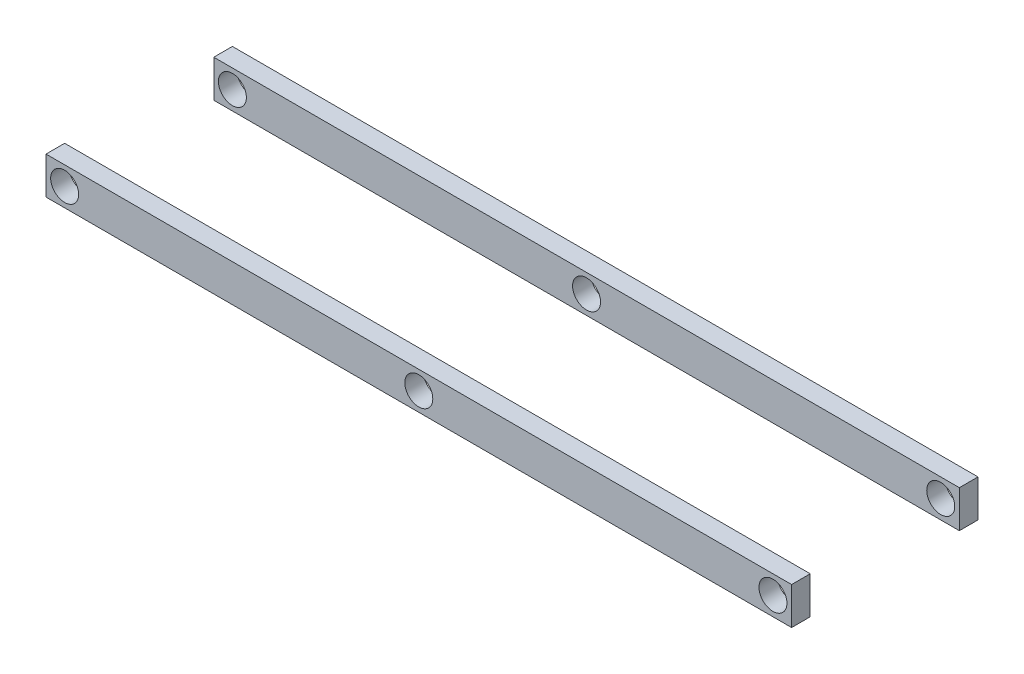
from build123d import *

# Parameters (mm, degrees)
SKETCH1_W           = 40
SKETCH1_H           = 10
BOSS_EXTRUDE1_DEPTH = 2
SKETCH4_W           = 40
SKETCH4_H           = 8
CUT_EXTRUDE2_DEPTH  = 2
SKETCH5_R           = 0.75
CUT_EXTRUDE3_DEPTH  = 42.279534881


with BuildPart() as part:
    # Sketch1 → Boss-Extrude1 (new body)
    with BuildSketch(Plane(origin=(0, 0, 0), x_dir=(1, 0, 0), z_dir=(0, 1, 0))):
        with Locations((20, 5)):
            Rectangle(SKETCH1_W, SKETCH1_H)
    extrude(amount=BOSS_EXTRUDE1_DEPTH)

    # Sketch4 → Cut-Extrude2 (cut)
    with BuildSketch(Plane(origin=(0, 2, 0), x_dir=(1, 0, 0), z_dir=(0, 1, 0))):
        with Locations((20, 5)):
            Rectangle(SKETCH4_W, SKETCH4_H)
    extrude(amount=-CUT_EXTRUDE2_DEPTH, mode=Mode.SUBTRACT)


with BuildPart() as cut_extrude2_piece_1:
    # of the separate pieces the step leaves, piece 1, a body of its own (cut_extrude2_pieces)
    add(part.part.solids().sort_by_distance((0, 0, 0))[0])


with BuildPart() as cut_extrude2_piece_2:
    # of the separate pieces the step leaves, piece 2, a body of its own (cut_extrude2_pieces)
    add(part.part.solids().sort_by_distance((0, 0, -10))[0])


with BuildPart() as cut_extrude3_tool:
    # Sketch5 → Cut-Extrude3 (new, through all)
    with BuildSketch(Plane.XY):
        with Locations((20, 1)):
            Circle(SKETCH5_R)
        with Locations((1, 1)):
            Circle(SKETCH5_R)
        with Locations((39, 1)):
            Circle(SKETCH5_R)
    extrude(amount=-CUT_EXTRUDE3_DEPTH)


with BuildPart() as cut_extrude2_piece_1_1:
    add(cut_extrude2_piece_1.part)

    # Cut-Extrude3: cut by cut_extrude3_tool
    add(cut_extrude3_tool.part, mode=Mode.SUBTRACT)


with BuildPart() as cut_extrude2_piece_2_1:
    add(cut_extrude2_piece_2.part)

    # Cut-Extrude3: cut by cut_extrude3_tool
    add(cut_extrude3_tool.part, mode=Mode.SUBTRACT)


solid = Compound([cut_extrude2_piece_1_1.part, cut_extrude2_piece_2_1.part])
